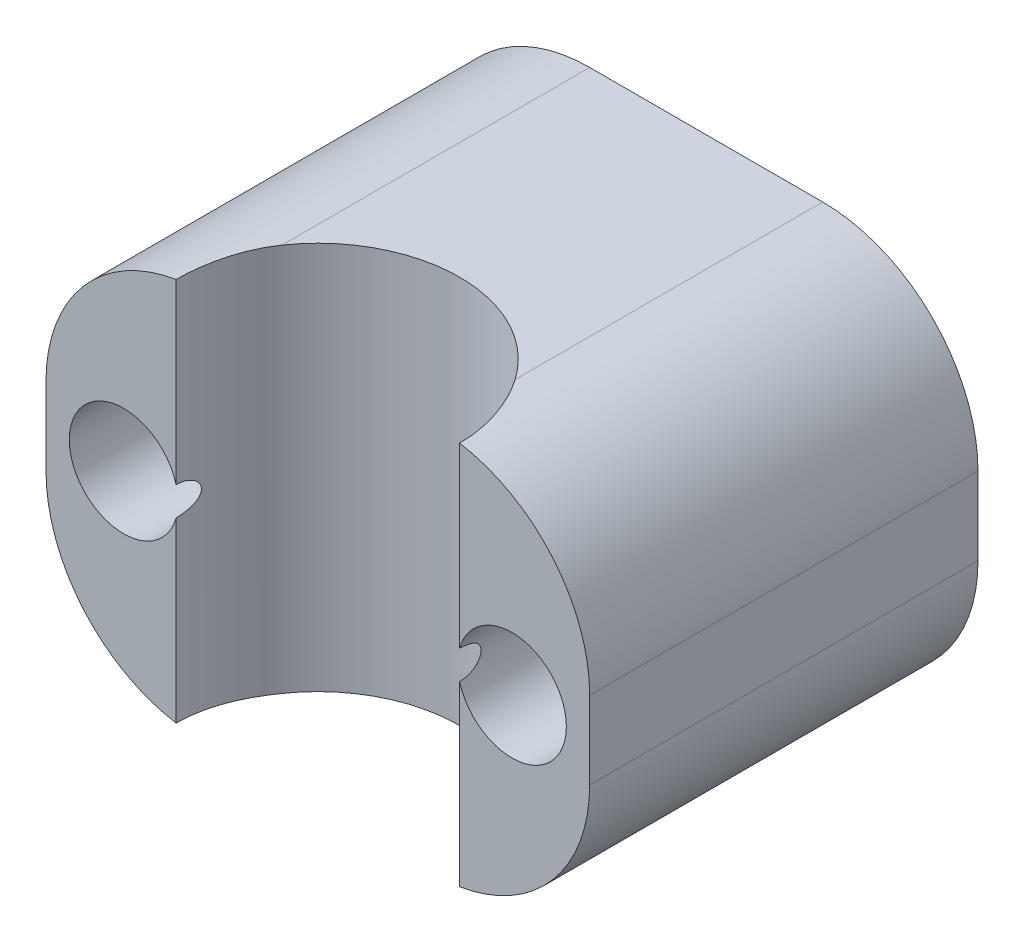
from build123d import *

# Parameters (mm, degrees)
EXTRUDE_1_DEPTH     = 10
CUT_EXTRUDE_1_REACH = 17.78
SKETCH_2_R          = 3.65
CUT_EXTRUDE_2_REACH = 15.191
SKETCH_3_R          = 1.4


with BuildPart() as part:
    # Эскиз1 → Бобышка-Вытянуть1 (new body)
    with BuildSketch(Plane.XY):
        with BuildLine():
            Line((-3, 5), (3, 5))
            ThreePointArc((3, 5), (5.828427125, 3.828427125), (7, 1))
            Line((7, 1), (7, -1))
            ThreePointArc((7, -1), (5.828427125, -3.828427125), (3, -5))
            Line((3, -5), (-3, -5))
            ThreePointArc((-3, -5), (-5.828427125, -3.828427125), (-7, -1))
            Line((-7, -1), (-7, 1))
            ThreePointArc((-7, 1), (-5.828427125, 3.828427125), (-3, 5))
        make_face()
    extrude(amount=EXTRUDE_1_DEPTH)

    # Эскиз2 → Вырез-Вытянуть1 (cut, up to next)
    with BuildSketch(Plane(origin=(0, 5, 0), x_dir=(1, 0, 0), z_dir=(0, 1, 0)), mode=Mode.PRIVATE) as cut_extrude_1_sk1:
        with Locations((0, -10)):
            Circle(SKETCH_2_R)
    cut_extrude_1_tool1 = extrude(cut_extrude_1_sk1.sketch, amount=-CUT_EXTRUDE_1_REACH, mode=Mode.PRIVATE) & part.part
    add(cut_extrude_1_tool1.solids().sort_by_distance((0, 5, 10))[0], mode=Mode.SUBTRACT)

    # Эскиз3 → Вырез-Вытянуть2 (cut, up to next)
    with BuildSketch(Plane.XY.offset(10), mode=Mode.PRIVATE) as cut_extrude_2_sk1:
        with Locations((-5, 0)):
            Circle(SKETCH_3_R)
    cut_extrude_2_tool1 = extrude(cut_extrude_2_sk1.sketch, amount=-CUT_EXTRUDE_2_REACH, mode=Mode.PRIVATE) & part.part
    # Эскиз3 → Вырез-Вытянуть2 (cut, up to next)
    with BuildSketch(Plane.XY.offset(10), mode=Mode.PRIVATE) as cut_extrude_2_sk2:
        with Locations((5, 0)):
            Circle(SKETCH_3_R)
    cut_extrude_2_tool2 = extrude(cut_extrude_2_sk2.sketch, amount=-CUT_EXTRUDE_2_REACH, mode=Mode.PRIVATE) & part.part
    add(cut_extrude_2_tool1.solids().sort_by_distance((-5, 0, 10))[0], mode=Mode.SUBTRACT)
    add(cut_extrude_2_tool2.solids().sort_by_distance((5, 0, 10))[0], mode=Mode.SUBTRACT)


solid = part.part
